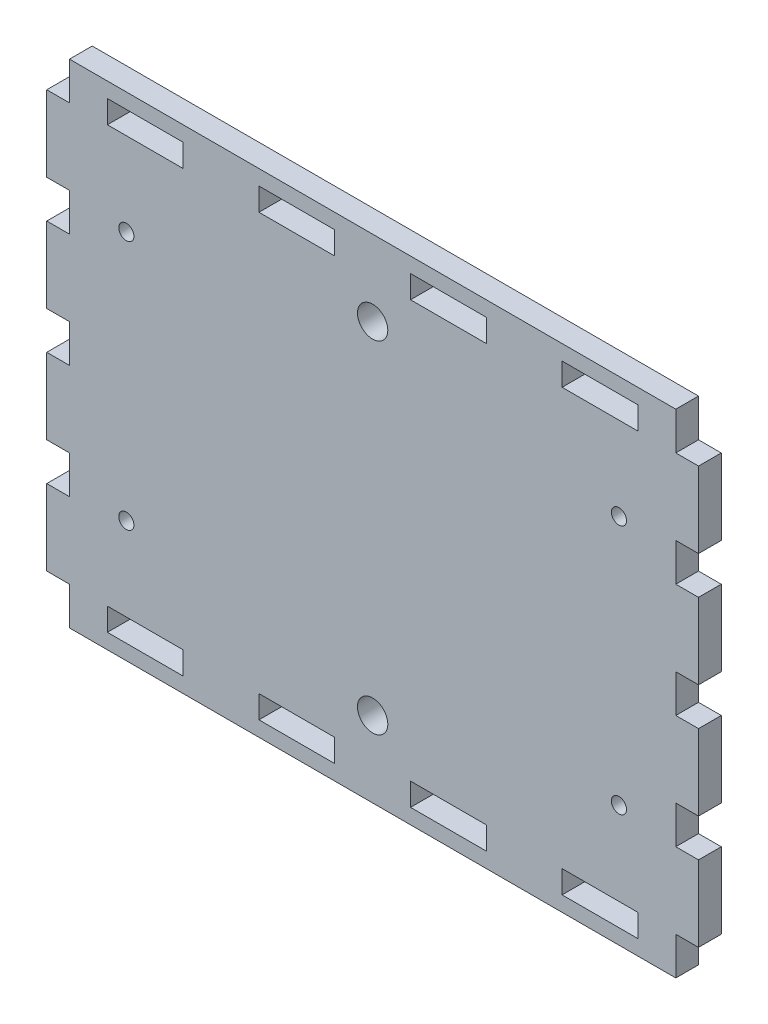
from build123d import *

# Parameters (mm, degrees)
SKETCH_1_R      = 1
SKETCH_1_R_2    = 2
SKETCH_1_W      = 10
SKETCH_1_H      = 3
EXTRUDE_1_DEPTH = 3


with BuildPart() as part:
    # 草图1 → 凸台-拉伸1 (new body)
    with BuildSketch(Plane.XY):
        Polygon((-40, 17.5), (-40, 12.5), (-43, 12.5), (-43, 2.5), (-40, 2.5), (-40, -2.5), (-43, -2.5), (-43, -12.5), (-40, -12.5), (-40, -17.5), (-43, -17.5), (-43, -27.5), (-40, -27.5), (-40, -32.5), (40, -32.5), (40, -27.5), (43, -27.5), (43, -17.5), (40, -17.5), (40, -12.5), (43, -12.5), (43, -2.5), (40, -2.5), (40, 2.5), (43, 2.5), (43, 12.5), (40, 12.5), (40, 17.5), (43, 17.5), (43, 27.5), (40, 27.5), (40, 32.5), (-40, 32.5), (-40, 27.5), (-43, 27.5), (-43, 17.5), align=None)
        with Locations((-32.5, 16.5)):
            Circle(SKETCH_1_R, mode=Mode.SUBTRACT)
        with Locations(Location((32.5, 16.5, 0), (0, 0, 180))):
            Circle(SKETCH_1_R, mode=Mode.SUBTRACT)
        with Locations(Location((-32.5, -16.5, 0), (0, 0, 180))):
            Circle(SKETCH_1_R, mode=Mode.SUBTRACT)
        with Locations((32.5, -16.5)):
            Circle(SKETCH_1_R, mode=Mode.SUBTRACT)
        with Locations((0, 22.5)):
            Circle(SKETCH_1_R_2, mode=Mode.SUBTRACT)
        with Locations(Location((0, -22.5, 0), (0, 0, 180))):
            Circle(SKETCH_1_R_2, mode=Mode.SUBTRACT)
        with Locations((-10, 29)):
            Rectangle(SKETCH_1_W, SKETCH_1_H, mode=Mode.SUBTRACT)
        with Locations((-30, 29)):
            Rectangle(SKETCH_1_W, SKETCH_1_H, mode=Mode.SUBTRACT)
        with Locations((10, 29)):
            Rectangle(SKETCH_1_W, SKETCH_1_H, mode=Mode.SUBTRACT)
        with Locations((30, 29)):
            Rectangle(SKETCH_1_W, SKETCH_1_H, mode=Mode.SUBTRACT)
        with Locations((30, -29)):
            Rectangle(SKETCH_1_W, SKETCH_1_H, mode=Mode.SUBTRACT)
        with Locations((10, -29)):
            Rectangle(SKETCH_1_W, SKETCH_1_H, mode=Mode.SUBTRACT)
        with Locations((-10, -29)):
            Rectangle(SKETCH_1_W, SKETCH_1_H, mode=Mode.SUBTRACT)
        with Locations((-30, -29)):
            Rectangle(SKETCH_1_W, SKETCH_1_H, mode=Mode.SUBTRACT)
    extrude(amount=EXTRUDE_1_DEPTH)


solid = part.part
